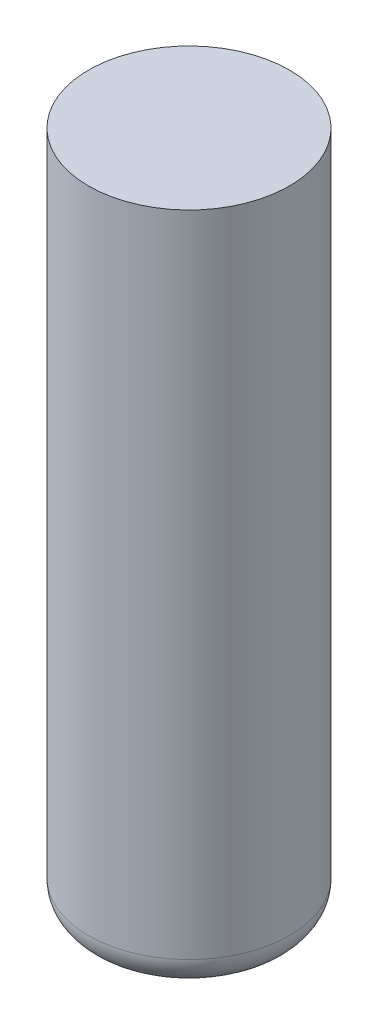
from build123d import *

# Parameters (mm, degrees)
SKETCH1_R           = 32.5
BOSS_EXTRUDE1_DEPTH = 220
FILLET1_R           = 10


with BuildPart() as part:
    # Sketch1 → Boss-Extrude1 (new body)
    with BuildSketch(Plane(origin=(0, 0, 0), x_dir=(1, 0, 0), z_dir=(0, 1, 0))):
        with Locations(Location((0, 0, 0), (0, 0, 270))):
            Circle(SKETCH1_R)
    extrude(amount=BOSS_EXTRUDE1_DEPTH)

    # Fillet1
    fillet1_edges = [part.edges().sort_by_distance(p)[0] for p in [
        (0, 0, -32.5),
    ]]
    fillet(fillet1_edges, radius=FILLET1_R)


solid = part.part
